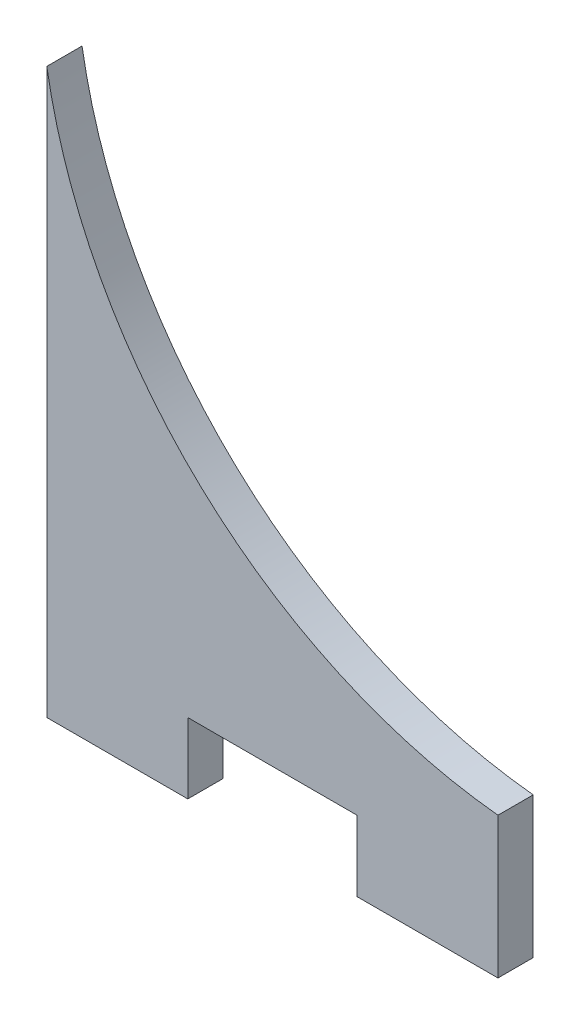
from build123d import *

# Parameters (mm, degrees)
BOSS_EXTRUDE1_DEPTH = 6.35


with BuildPart() as part:
    # Sketch1 → Boss-Extrude1 (new body)
    with BuildSketch(Plane.XY):
        with BuildLine():
            ThreePointArc((0, 76.2), (27.810396475, 24.415089573), (81.28, 0))
            Line((81.28, 0), (0, 0))
            Line((0, 0), (0, 76.2))
        make_face()
        Polygon((0, -25.4), (0, 0), (81.28, 0), (81.28, -25.4), (55.88, -25.4), (55.88, -12.7), (25.4, -12.7), (25.4, -25.4), align=None)
    extrude(amount=BOSS_EXTRUDE1_DEPTH)


solid = part.part
